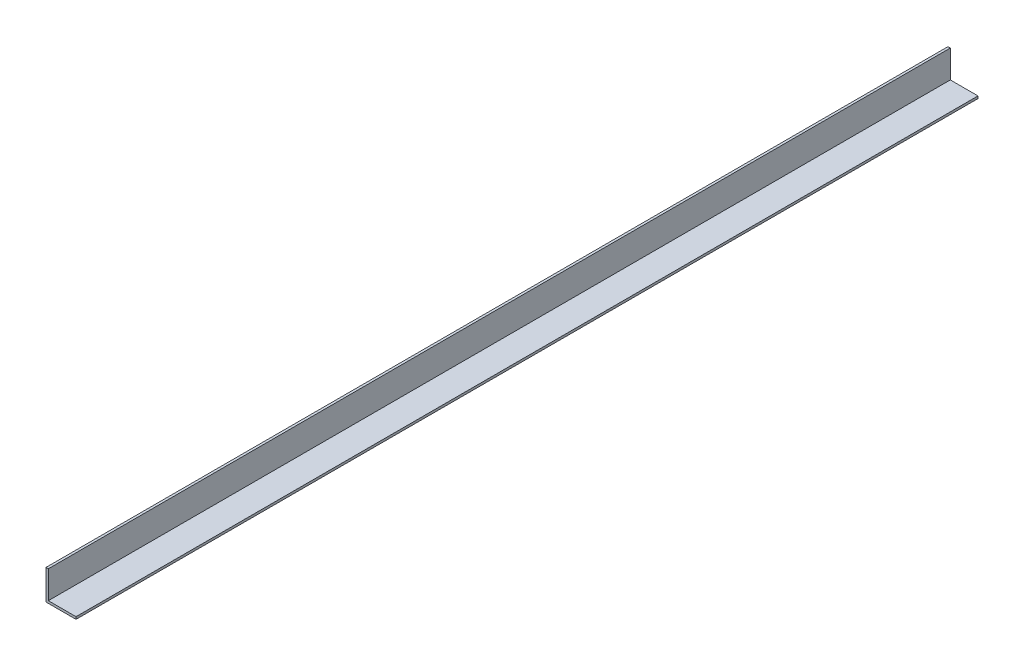
from build123d import *

# Parameters (mm, degrees)
SALIENTE_EXTRUIR1_DEPTH = 6100


with BuildPart() as part:
    # Croquis1 → Saliente-Extruir1 (new body)
    with BuildSketch(Plane.XY):
        Polygon((0, 203), (0, 0), (203, 0), (203, 15.88), (15.88, 15.88), (15.88, 203), align=None)
    extrude(amount=-SALIENTE_EXTRUIR1_DEPTH)


solid = part.part
